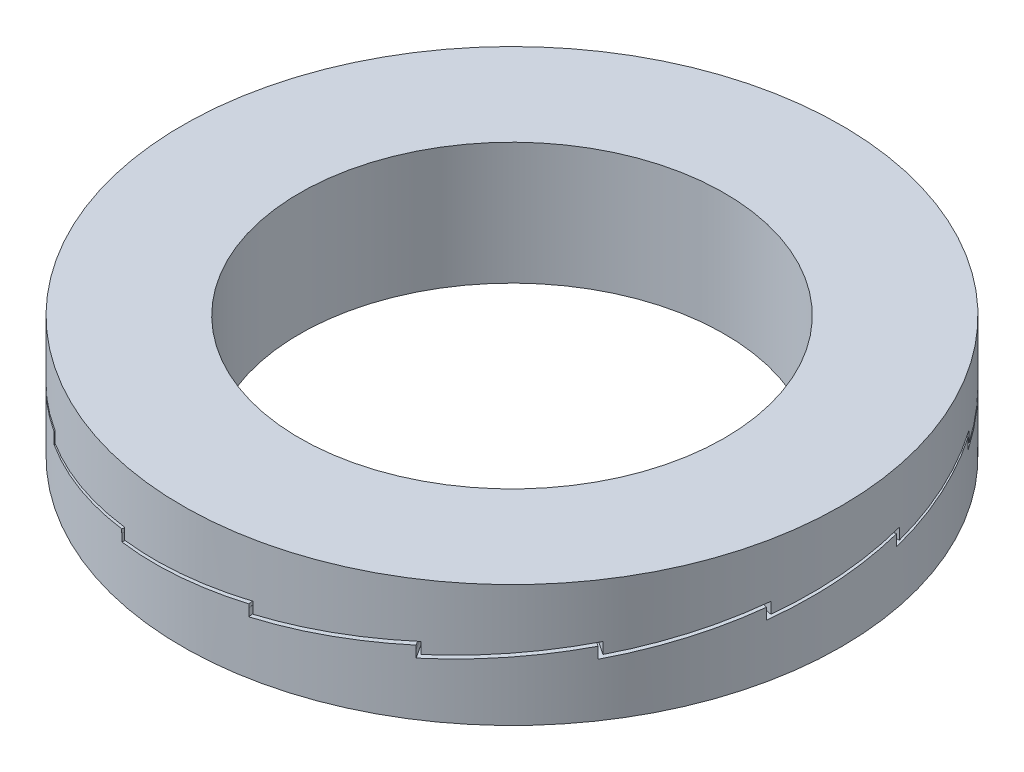
from build123d import *

# Parameters (mm, degrees)
SKETCH3_W                 = 2.4
SKETCH3_H                 = 2.5
PATTERN_CUT_PROFILE_COUNT = 16
PATTERN_CUT_PROFILE_ANGLE = 337.5


with BuildPart() as part:
    # Sketch3 → Base-Revolve (revolve)
    with BuildSketch(Plane.XY):
        with Locations((5.55, 0)):
            Rectangle(SKETCH3_W, SKETCH3_H)
    revolve(axis=Axis((0, -1.25, 0), (0, 1, 0)))

    # Sketch12 → Cut-Profile section 0
    with BuildSketch(Plane(origin=(6.206961255, 0, 0), x_dir=(0, 0, -1), z_dir=(1, 0, 0))):
        with BuildLine():
            Line((-1.302602361, -0.148073241), (1.166680354, 0.067961003))
            Line((1.166680354, 0.067961003), (1.166680354, 0))
            Line((1.166680354, 0), (1.234641358, 0))
            Line((1.234641358, 0), (1.234641358, 0.142127424))
            Line((1.234641358, 0.142127424), (-1.234641358, -0.073906821))
            Line((-1.234641358, -0.073906821), (-1.234641358, 0))
            Line((-1.234641358, 0), (-1.302602361, 0))
            Line((-1.302602361, 0), (-1.302602361, -0.148073241))
        make_face()
    # Sketch15 → Cut-Profile section 1
    with BuildSketch(Plane(origin=(6.75, 0, 0), x_dir=(0, 0, -1), z_dir=(1, 0, 0))):
        with BuildLine():
            Line((-1.419309481, 0), (-1.34265848, 0))
            Line((-1.34265848, 0), (-1.34265848, -0.083357094))
            Line((-1.34265848, -0.083357094), (1.34265848, 0.151577698))
            Line((1.34265848, 0.151577698), (1.34265848, 0))
            Line((1.34265848, 0), (1.266007479, 0))
            Line((1.266007479, 0), (1.266007479, 0.076651001))
            Line((1.266007479, 0.076651001), (-1.419309481, -0.158283791))
            Line((-1.419309481, -0.158283791), (-1.419309481, 0))
        make_face()
    cut_profile = loft(mode=Mode.SUBTRACT)

    # Pattern-Cut-Profile: Cut-Profile ×16 about axis
    pattern_cut_profile_axis = Axis((0, -1.25, 0), (0, 1, 0))
    for i in range(1, PATTERN_CUT_PROFILE_COUNT):
        add(cut_profile.rotate(pattern_cut_profile_axis, i * PATTERN_CUT_PROFILE_ANGLE / (PATTERN_CUT_PROFILE_COUNT - 1)), mode=Mode.SUBTRACT)


solid = part.part
